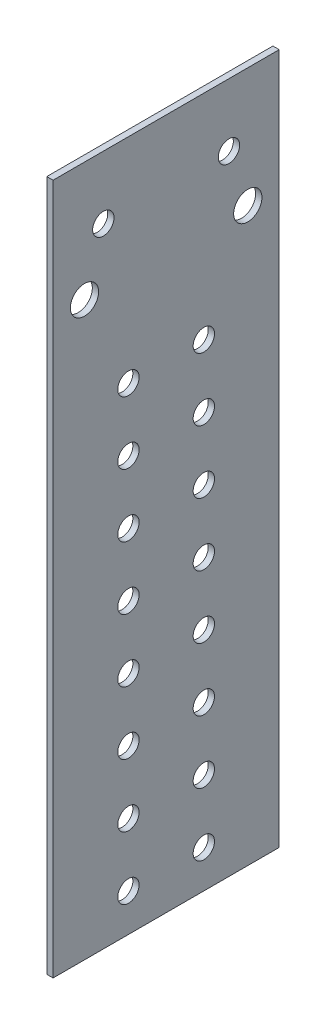
from build123d import *

# Parameters (mm, degrees)
SKETCH1_W            = 36
SKETCH1_H            = 110
BOSS_EXTRUDE1_DEPTH  = 1
M3_CLEARANCE_HOLE1_D = 3.4
M4_CLEARANCE_HOLE1_D = 4.5
M3_CLEARANCE_HOLE2_D = 3.4


with BuildPart() as part:
    # Sketch1 → Boss-Extrude1 (new body)
    with BuildSketch(Plane(origin=(0, 0, 0), x_dir=(0, 0, -1), z_dir=(1, 0, 0))):
        with Locations((0, -55)):
            Rectangle(SKETCH1_W, SKETCH1_H)
    extrude(amount=BOSS_EXTRUDE1_DEPTH)

    # M3 Clearance Hole1 (through all)
    with Locations(Plane.ZY):
        with Locations((-10, -10), (10, -10)):
            Hole(M3_CLEARANCE_HOLE1_D / 2)

    # M4 Clearance Hole1 (through all)
    with Locations(Plane.ZY):
        with Locations((-13, -19), (13, -19)):
            Hole(M4_CLEARANCE_HOLE1_D / 2)

    # M3 Clearance Hole2 (through all)
    with Locations(Plane(origin=(1, 0, 0), x_dir=(0, 0, -1), z_dir=(1, 0, 0))):
        with Locations((6, -104), (-6, -104), (6, -94), (-6, -94), (6, -84), (-6, -84), (6, -74), (-6, -74), (6, -64), (-6, -64), (6, -54), (-6, -54), (6, -44), (-6, -44), (6, -34), (-6, -34)):
            Hole(M3_CLEARANCE_HOLE2_D / 2)


solid = part.part
